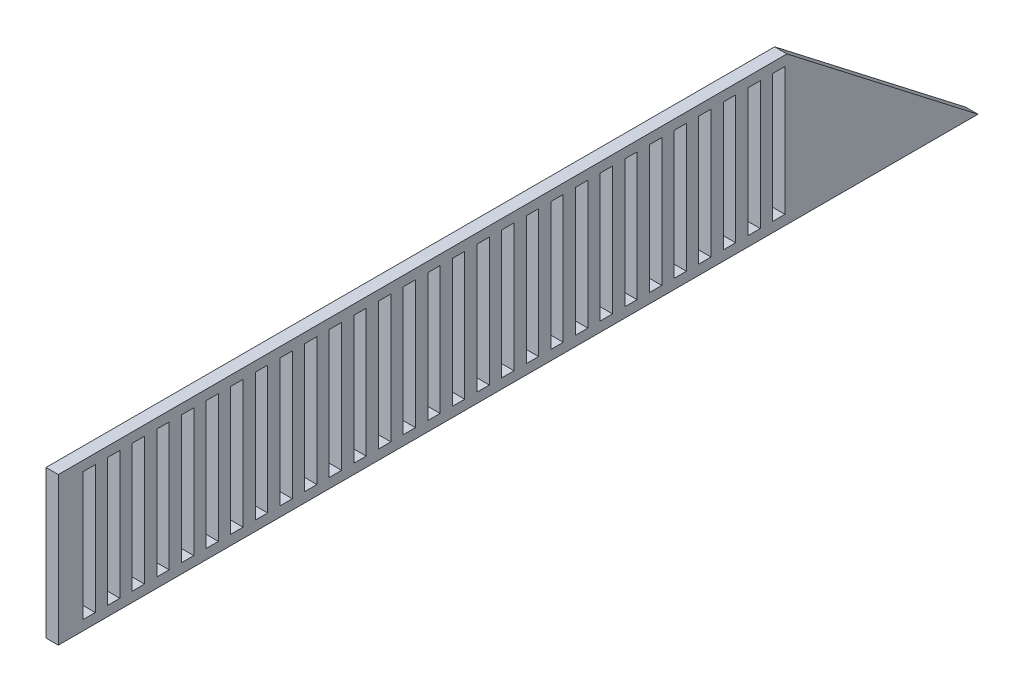
from build123d import *

# Parameters (mm, degrees)
SKETCH1_W           = 6.35
SKETCH1_H           = 66.04
BOSS_EXTRUDE1_DEPTH = 6.35


with BuildPart() as part:
    # Sketch1 → Boss-Extrude1 (new body)
    with BuildSketch(Plane(origin=(0, 0, 0), x_dir=(0, 0, -1), z_dir=(1, 0, 0))):
        Polygon((-237.109, 0), (237.109, 0), (138.588815033, 76.2), (-237.109, 76.2), align=None)
        with Locations((-208.534, 38.1)):
            Rectangle(SKETCH1_W, SKETCH1_H, mode=Mode.SUBTRACT)
        with Locations((-221.234, 38.1)):
            Rectangle(SKETCH1_W, SKETCH1_H, mode=Mode.SUBTRACT)
        with Locations((-195.834, 38.1)):
            Rectangle(SKETCH1_W, SKETCH1_H, mode=Mode.SUBTRACT)
        with Locations((-183.134, 38.1)):
            Rectangle(SKETCH1_W, SKETCH1_H, mode=Mode.SUBTRACT)
        with Locations((-170.434, 38.1)):
            Rectangle(SKETCH1_W, SKETCH1_H, mode=Mode.SUBTRACT)
        with Locations((-157.734, 38.1)):
            Rectangle(SKETCH1_W, SKETCH1_H, mode=Mode.SUBTRACT)
        with Locations((-145.034, 38.1)):
            Rectangle(SKETCH1_W, SKETCH1_H, mode=Mode.SUBTRACT)
        with Locations((-132.334, 38.1)):
            Rectangle(SKETCH1_W, SKETCH1_H, mode=Mode.SUBTRACT)
        with Locations((-119.634, 38.1)):
            Rectangle(SKETCH1_W, SKETCH1_H, mode=Mode.SUBTRACT)
        with Locations((-106.934, 38.1)):
            Rectangle(SKETCH1_W, SKETCH1_H, mode=Mode.SUBTRACT)
        with Locations((-94.234, 38.1)):
            Rectangle(SKETCH1_W, SKETCH1_H, mode=Mode.SUBTRACT)
        with Locations((-81.534, 38.1)):
            Rectangle(SKETCH1_W, SKETCH1_H, mode=Mode.SUBTRACT)
        with Locations((-68.834, 38.1)):
            Rectangle(SKETCH1_W, SKETCH1_H, mode=Mode.SUBTRACT)
        with Locations((-56.134, 38.1)):
            Rectangle(SKETCH1_W, SKETCH1_H, mode=Mode.SUBTRACT)
        with Locations((-43.434, 38.1)):
            Rectangle(SKETCH1_W, SKETCH1_H, mode=Mode.SUBTRACT)
        with Locations((-30.734, 38.1)):
            Rectangle(SKETCH1_W, SKETCH1_H, mode=Mode.SUBTRACT)
        with Locations((-18.034, 38.1)):
            Rectangle(SKETCH1_W, SKETCH1_H, mode=Mode.SUBTRACT)
        with Locations((-5.334, 38.1)):
            Rectangle(SKETCH1_W, SKETCH1_H, mode=Mode.SUBTRACT)
        with Locations((7.366, 38.1)):
            Rectangle(SKETCH1_W, SKETCH1_H, mode=Mode.SUBTRACT)
        with Locations((20.066, 38.1)):
            Rectangle(SKETCH1_W, SKETCH1_H, mode=Mode.SUBTRACT)
        with Locations((32.766, 38.1)):
            Rectangle(SKETCH1_W, SKETCH1_H, mode=Mode.SUBTRACT)
        with Locations((45.466, 38.1)):
            Rectangle(SKETCH1_W, SKETCH1_H, mode=Mode.SUBTRACT)
        with Locations((58.166, 38.1)):
            Rectangle(SKETCH1_W, SKETCH1_H, mode=Mode.SUBTRACT)
        with Locations((70.866, 38.1)):
            Rectangle(SKETCH1_W, SKETCH1_H, mode=Mode.SUBTRACT)
        with Locations((83.566, 38.1)):
            Rectangle(SKETCH1_W, SKETCH1_H, mode=Mode.SUBTRACT)
        with Locations((96.266, 38.1)):
            Rectangle(SKETCH1_W, SKETCH1_H, mode=Mode.SUBTRACT)
        with Locations((108.966, 38.1)):
            Rectangle(SKETCH1_W, SKETCH1_H, mode=Mode.SUBTRACT)
        with Locations((121.666, 38.1)):
            Rectangle(SKETCH1_W, SKETCH1_H, mode=Mode.SUBTRACT)
        with Locations((134.366, 38.1)):
            Rectangle(SKETCH1_W, SKETCH1_H, mode=Mode.SUBTRACT)
    extrude(amount=-BOSS_EXTRUDE1_DEPTH)


solid = part.part
